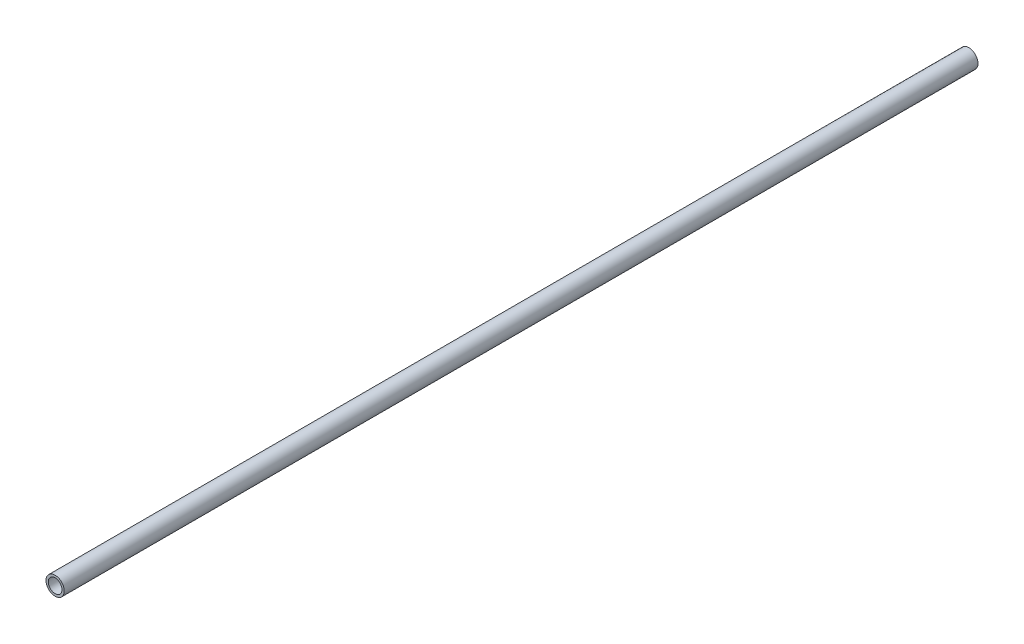
from build123d import *

# Parameters (mm, degrees)
SKETCH_1_R      = 4
SKETCH_1_R_2    = 3
EXTRUDE_1_DEPTH = 400


with BuildPart() as part:
    # 草图1 → 凸台-拉伸1 (new body)
    with BuildSketch(Plane.XY):
        Circle(SKETCH_1_R)
        Circle(SKETCH_1_R_2, mode=Mode.SUBTRACT)
    extrude(amount=EXTRUDE_1_DEPTH)


solid = part.part
